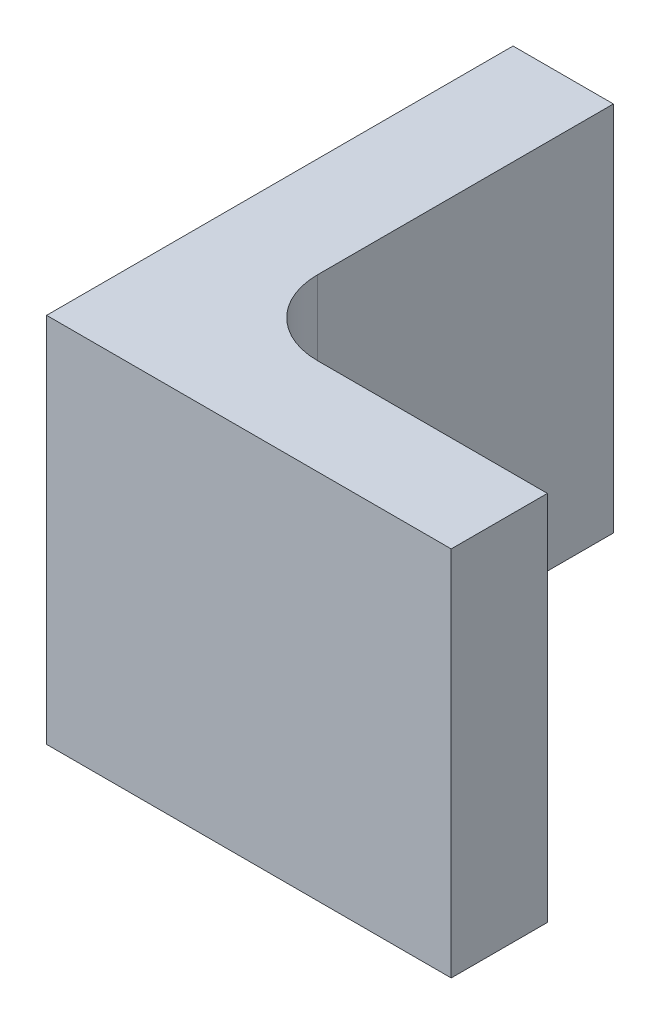
from build123d import *

# Parameters (mm, degrees)
BOSS_EXTRUDE1_DEPTH = 50
FILLET1_R           = 10


with BuildPart() as part:
    # Sketch1 → Boss-Extrude1 (new body)
    with BuildSketch(Plane(origin=(0, 0, 0), x_dir=(1, 0, 0), z_dir=(0, 1, 0))):
        Polygon((0, 0), (54.440853042, 0), (54.440853042, 12.938550984), (13.500960377, 12.938550984), (13.500960377, 62.761627907), (0, 62.761627907), align=None)
    extrude(amount=BOSS_EXTRUDE1_DEPTH)

    # Fillet1
    fillet1_edges = [part.edges().sort_by_distance(p)[0] for p in [
        (13.500960377, 25, -12.938550984),
    ]]
    fillet(fillet1_edges, radius=FILLET1_R)


solid = part.part
